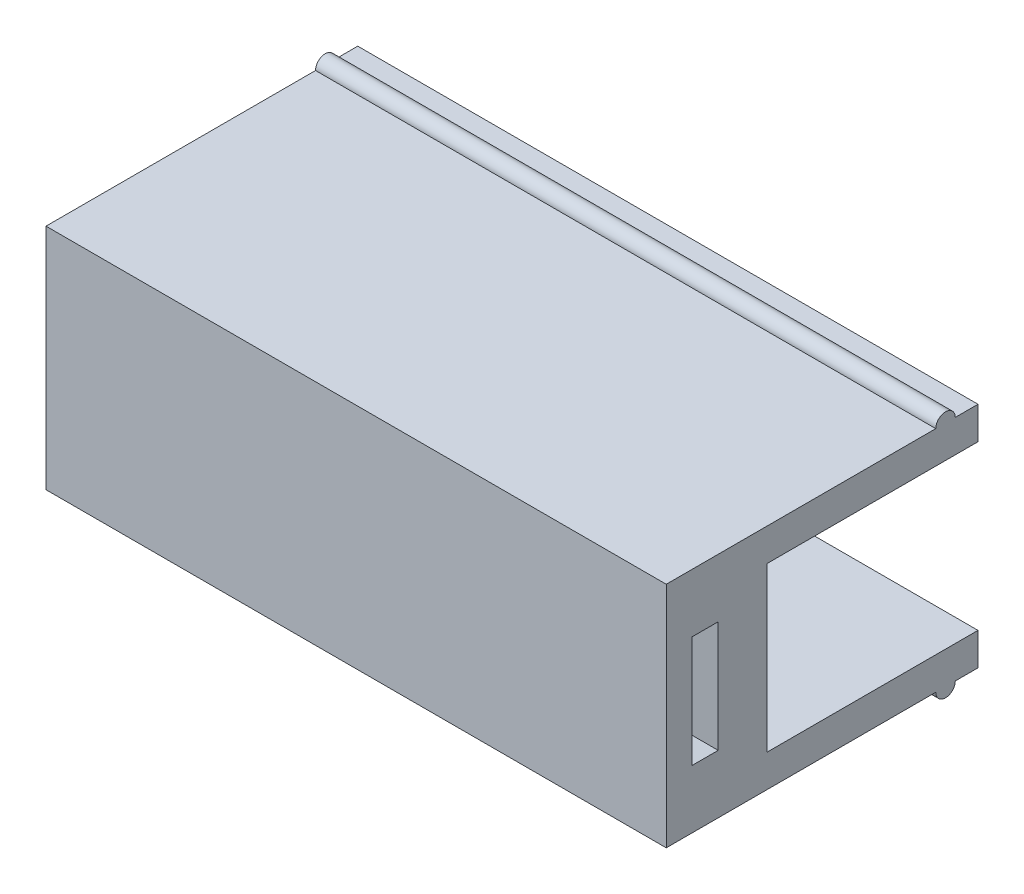
from build123d import *

# Parameters (mm, degrees)
SKETCH_3_W          = 19.1
SKETCH_3_H          = 7.03
EXTRUDE_2_DEPTH     = 9.6
SKETCH_7_W          = 19.1
SKETCH_7_H          = 5.03
CUT_EXTRUDE_2_DEPTH = 6.5
SKETCH_8_R          = 0.3
EXTRUDE_4_DEPTH     = 19.1
SKETCH_11_W         = 0.8
SKETCH_11_H         = 3.43
CUT_EXTRUDE_4_DEPTH = 0.8
CUT_EXTRUDE_4_DRAFT = -20
SKETCH_12_W         = 0.8
SKETCH_12_H         = 3.43
CUT_EXTRUDE_5_DEPTH = 0.8
CUT_EXTRUDE_5_DRAFT = -20


with BuildPart() as part:
    # Эскиз3 → Бобышка-Вытянуть2 (new body)
    with BuildSketch(Plane.XY):
        Rectangle(SKETCH_3_W, SKETCH_3_H)
    extrude(amount=EXTRUDE_2_DEPTH)

    # Эскиз7 → Вырез-Вытянуть2 (cut)
    with BuildSketch(Plane(origin=(0, 0, 0), x_dir=(-1, 0, 0), z_dir=(0, 0, -1))):
        Rectangle(SKETCH_7_W, SKETCH_7_H)
    extrude(amount=-CUT_EXTRUDE_2_DEPTH, mode=Mode.SUBTRACT)

    # Эскиз8 → Бобышка-Вытянуть4 (add)
    with BuildSketch(Plane(origin=(9.55, 0, 0), x_dir=(0, 0, -1), z_dir=(1, 0, 0))):
        with Locations((-1, -3.515)):
            Circle(SKETCH_8_R)
        with Locations((-1, 3.515)):
            Circle(SKETCH_8_R)
    extrude(amount=-EXTRUDE_4_DEPTH)


with BuildPart() as cut_extrude_4_tool:
    # Эскиз11 → Вырез-Вытянуть4 (with draft: the straight prism first)
    with BuildSketch(Plane(origin=(9.55, 0, 0), x_dir=(0, 0, -1), z_dir=(1, 0, 0))):
        with Locations((-8.4, 0)):
            Rectangle(SKETCH_11_W, SKETCH_11_H)
    extrude(amount=-CUT_EXTRUDE_4_DEPTH)
    # Вырез-Вытянуть4: the draft: its side faces are tilted about the plane it starts from
    cut_extrude_4_sides = [cut_extrude_4_tool.faces().sort_by_distance(p)[0] for p in [
        (9.15, 0, 8.8),
        (9.15, -1.715, 8.4),
        (9.15, 0, 8),
        (9.15, 1.715, 8.4),
    ]]
    draft(cut_extrude_4_sides, Plane(origin=(9.55, 0, 0), x_dir=(0, 0, -1), z_dir=(1, 0, 0)), CUT_EXTRUDE_4_DRAFT)


with BuildPart() as part_1:
    add(part.part)

    # Вырез-Вытянуть4: cut by cut_extrude_4_tool
    add(cut_extrude_4_tool.part, mode=Mode.SUBTRACT)


with BuildPart() as cut_extrude_5_tool:
    # Эскиз12 → Вырез-Вытянуть5 (with draft: the straight prism first)
    with BuildSketch(Plane.ZY.offset(9.55)):
        with Locations((8.4, 0)):
            Rectangle(SKETCH_12_W, SKETCH_12_H)
    extrude(amount=-CUT_EXTRUDE_5_DEPTH)
    # Вырез-Вытянуть5: the draft: its side faces are tilted about the plane it starts from
    cut_extrude_5_sides = [cut_extrude_5_tool.faces().sort_by_distance(p)[0] for p in [
        (-9.15, 0, 8),
        (-9.15, -1.715, 8.4),
        (-9.15, 0, 8.8),
        (-9.15, 1.715, 8.4),
    ]]
    draft(cut_extrude_5_sides, Plane.ZY.offset(9.55), CUT_EXTRUDE_5_DRAFT)


with BuildPart() as part_2:
    add(part_1.part)

    # Вырез-Вытянуть5: cut by cut_extrude_5_tool
    add(cut_extrude_5_tool.part, mode=Mode.SUBTRACT)


solid = part_2.part
